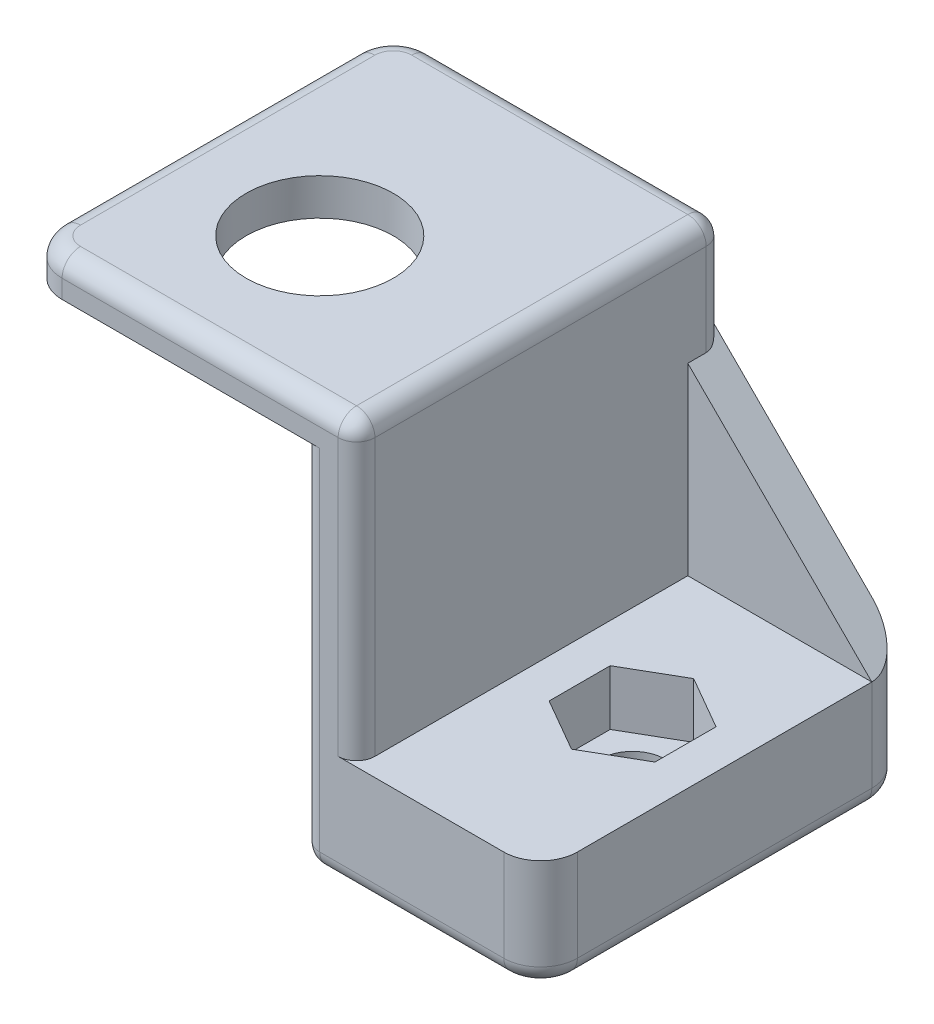
from build123d import *

# Parameters (mm, degrees)
BOSS_EXTRUDE1_DEPTH = 40
SKETCH3_R           = 3.5
CUT_EXTRUDE1_DEPTH  = 32
SKETCH2_R           = 8
CUT_EXTRUDE2_DEPTH  = 32
CUT_EXTRUDE3_DEPTH  = 6
BOSS_EXTRUDE3_DEPTH = 4
FILLET1_R           = 4
FILLET4_R           = 2


with BuildPart() as part:
    # Sketch1 → Boss-Extrude1 (new body)
    with BuildSketch(Plane.XY):
        Polygon((0, 0), (0, 40), (-30, 40), (-30, 44), (6, 44), (6, 12), (26, 12), (26, 0), align=None)
    extrude(amount=BOSS_EXTRUDE1_DEPTH)

    # Sketch3 → Cut-Extrude1 (cut)
    with BuildSketch(Plane(origin=(0, 12, 0), x_dir=(1, 0, 0), z_dir=(0, 1, 0))):
        with Locations(Location((16, -20, 0), (0, 0, 270))):
            Circle(SKETCH3_R)
    extrude(amount=-CUT_EXTRUDE1_DEPTH, mode=Mode.SUBTRACT)

    # Sketch2 → Cut-Extrude2 (cut)
    with BuildSketch(Plane(origin=(0, 44, 0), x_dir=(1, 0, 0), z_dir=(0, 1, 0))):
        with Locations(Location((-14, -24, 0), (0, 0, 270))):
            Circle(SKETCH2_R)
    extrude(amount=-CUT_EXTRUDE2_DEPTH, mode=Mode.SUBTRACT)

    # Sketch4 → Cut-Extrude3 (cut)
    with BuildSketch(Plane(origin=(0, 12, 0), x_dir=(1, 0, 0), z_dir=(0, 1, 0))):
        Polygon((16, -26.639528096), (21.75, -23.319764048), (21.75, -16.680235952), (16, -13.360471904), (10.25, -16.680235952), (10.25, -23.319764048), align=None)
    extrude(amount=-CUT_EXTRUDE3_DEPTH, mode=Mode.SUBTRACT)

    # Sketch5 → Boss-Extrude3 (add)
    with BuildSketch(Plane(origin=(0, 0, 0), x_dir=(-1, 0, 0), z_dir=(0, 0, -1))):
        Polygon((-26, 12), (-6, 32), (-6, 12), align=None)
        Polygon((0, 10), (0, 40), (30, 40), align=None)
    extrude(amount=-BOSS_EXTRUDE3_DEPTH)

    # Fillet1
    fillet1_edges = [part.edges().sort_by_distance(p)[0] for p in [
        (26, 6, 0),
        (-30, 42, 40),
        (26, 6, 40),
        (-30, 42, 0),
    ]]
    fillet(fillet1_edges, radius=FILLET1_R)

    # Fillet4
    fillet4_edges = [part.edges().sort_by_distance(p)[0] for p in [
        (11, 0, 0),
        (0, 0, 20),
        (6, 44, 20),
        (6, 28, 40),
        (-10, 44, 40),
        (0, 20, 40),
        (11, 0, 40),
        (6, 38, 0),
        (26, 0, 20),
        (24.828427125, 0, 1.171572875),
        (24.828427125, 0, 38.828427125),
        (-30, 44, 20),
        (-28.828427125, 44, 1.171572875),
        (-28.828427125, 44, 38.828427125),
        (-10, 44, 0),
    ]]
    fillet(fillet4_edges, radius=FILLET4_R)


solid = part.part
